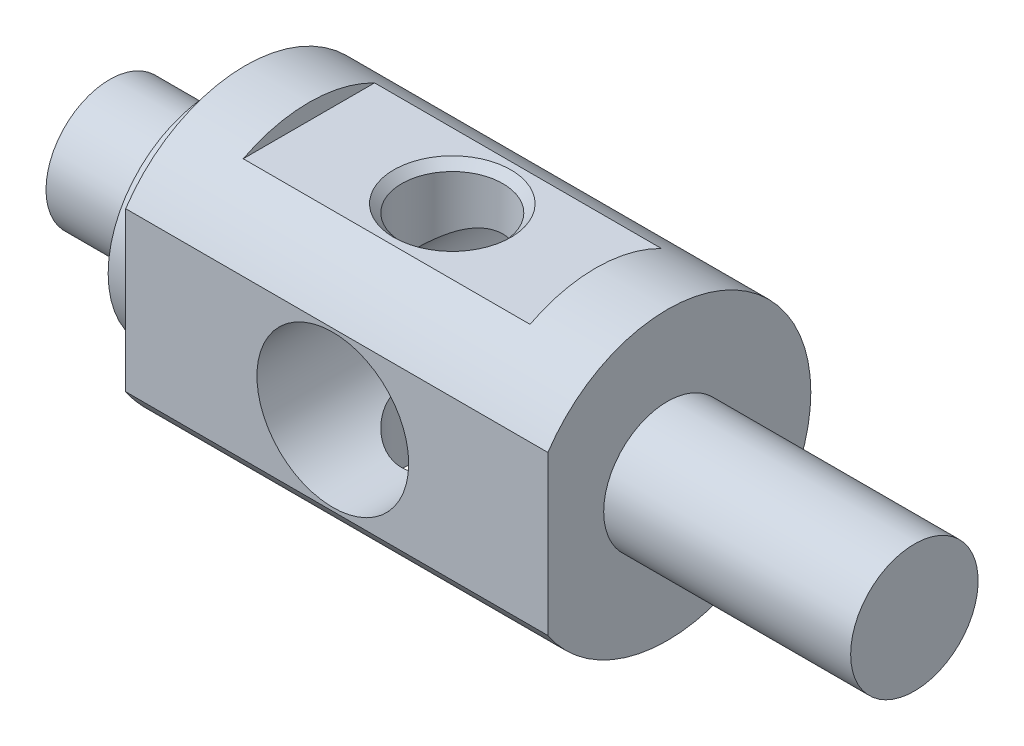
from build123d import *

# Parameters (mm, degrees)
SKETCH2_W                  = 30
SKETCH2_H                  = 12.7
CUT_EXTRUDE1_DEPTH         = 1.5
F_8_32_TAPPED_HOLE1_D      = 3.4544
F_8_32_TAPPED_HOLE1_DEPTH  = 10.71
F_8_32_TAPPED_HOLE1_TIP    = 1.037806461
SKETCH7_OUTSIDE_W          = 29.718
SKETCH7_OUTSIDE_H          = 31.218
SKETCH7_OUTSIDE_R          = 6.6
CUT_EXTRUDE2_DEPTH         = 2
F_3_8_0_3750_DOWEL_HOLE2_D = 9.525
CUT_EXTRUDE4_START         = 9
SKETCH11_W                 = 18
SKETCH11_H                 = 20
CUT_EXTRUDE4_DEPTH         = 1
F_1_4_0_2500_DOWEL_HOLE1_D = 6.35
CHAMFER1_SIZE              = 0.5


with BuildPart() as part:
    # Sketch1 → Revolve1 (revolve)
    with BuildSketch(Plane(origin=(0, 0, 0), x_dir=(1, 0, 0), z_dir=(0, 1, 0)), mode=Mode.PRIVATE) as revolve1_sk:
        Polygon((-21.5, 0), (29, 0), (29, 4), (13.5, 4), (13.5, 9), (-15, 9), (-15, 4), (-21.5, 4), align=None)
    revolve(revolve1_sk.sketch.rotate(Axis((-21.5, 0, 0), (1, 0, 0)), 180), axis=Axis((-21.5, 0, 0), (1, 0, 0)))

    # Sketch2 → Cut-Extrude1 (cut)
    with BuildSketch(Plane.XY.offset(9)):
        Rectangle(SKETCH2_W, SKETCH2_H)
    extrude(amount=-CUT_EXTRUDE1_DEPTH, mode=Mode.SUBTRACT)

    # #8-32 Tapped Hole1
    with Locations(Plane.ZY.offset(21.5)):
        with Locations((0, 0)):
            Hole(F_8_32_TAPPED_HOLE1_D / 2, depth=F_8_32_TAPPED_HOLE1_DEPTH)
            with Locations((0, 0, -(F_8_32_TAPPED_HOLE1_DEPTH + F_8_32_TAPPED_HOLE1_TIP / 2))):  # 118° drill point
                Cone(0, F_8_32_TAPPED_HOLE1_D / 2, F_8_32_TAPPED_HOLE1_TIP, mode=Mode.SUBTRACT)

    # Sketch7 outside → Cut-Extrude2 (cut)
    with BuildSketch(Plane.ZY.offset(15)):
        with Locations((-0.75, 0)):
            Rectangle(SKETCH7_OUTSIDE_W, SKETCH7_OUTSIDE_H)
        Circle(SKETCH7_OUTSIDE_R, mode=Mode.SUBTRACT)
    extrude(amount=-CUT_EXTRUDE2_DEPTH, mode=Mode.SUBTRACT)

    # 3/8 (0.3750) Dowel Hole2 (through all)
    with Locations(Plane.XY.offset(7.5)):
        with Locations((0, 0)):
            Hole(F_3_8_0_3750_DOWEL_HOLE2_D / 2)

    # Sketch11 → Cut-Extrude4 (cut)
    with BuildSketch(Plane(origin=(0, 0, 0), x_dir=(1, 0, 0), z_dir=(0, 1, 0)).offset(CUT_EXTRUDE4_START)):
        Rectangle(SKETCH11_W, SKETCH11_H)
    cut_extrude4 = extrude(amount=-CUT_EXTRUDE4_DEPTH, mode=Mode.SUBTRACT)

    # 1/4 (0.2500) Dowel Hole1 (through all)
    with Locations(Plane(origin=(0, 8, 0), x_dir=(1, 0, 0), z_dir=(0, 1, 0))):
        with Locations((0, 0)):
            Hole(F_1_4_0_2500_DOWEL_HOLE1_D / 2)

    # Mirror1: Cut-Extrude4 across plane
    add(cut_extrude4.mirror(Plane.ZX), mode=Mode.SUBTRACT)

    # Chamfer1
    chamfer1_edges = [part.edges().sort_by_distance(p)[0] for p in [
        (3.175, 8, 0),
    ]]
    chamfer(chamfer1_edges, length=CHAMFER1_SIZE)


solid = part.part
